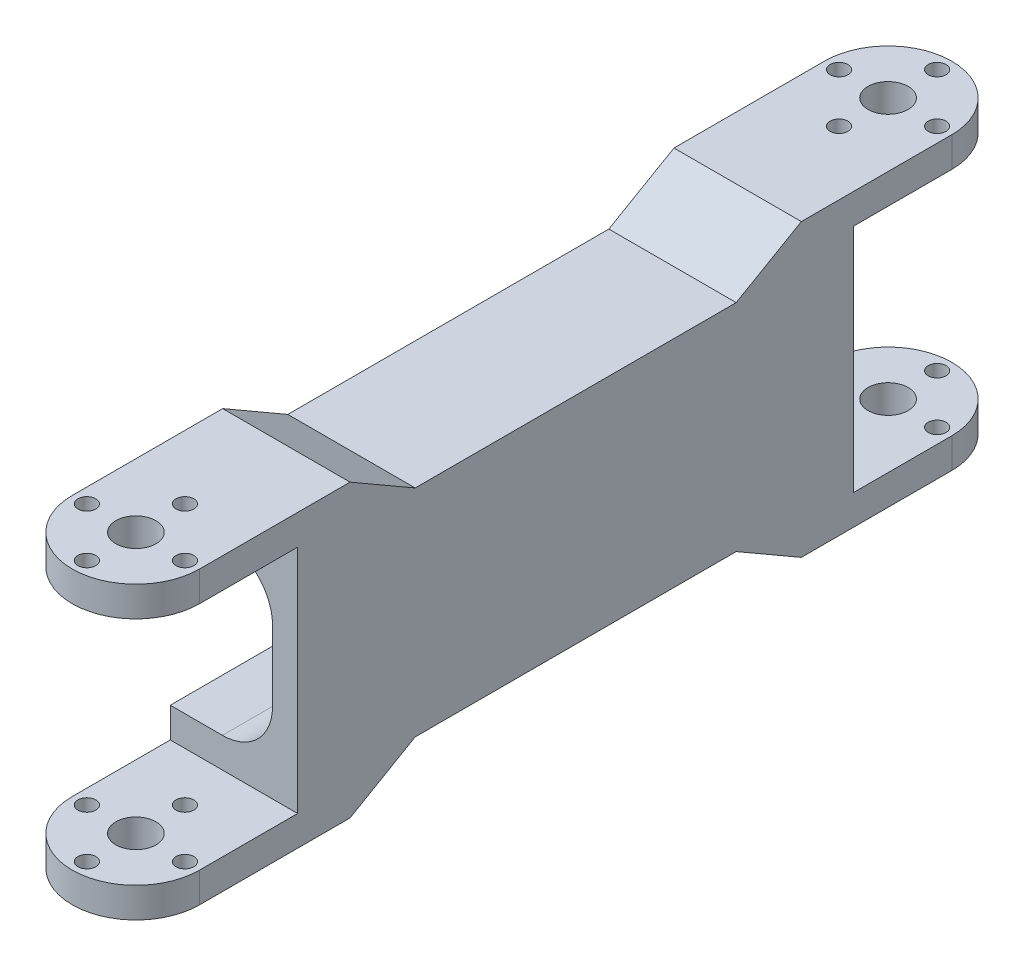
from build123d import *

# Parameters (mm, degrees)
BOSS_EXTRUDE1_DEPTH          = 29
CUT_EXTRUDE1_DEPTH           = 96.799008346
CUT_EXTRUDE2_DEPTH           = 96.799008346
CUT_EXTRUDE2_DEPTH_BACK      = 96.799008346
SKETCH4_W                    = 32.25
SKETCH4_H                    = 6
SKETCH5_W                    = 175.4
SKETCH5_H                    = 34
CUT_EXTRUDE3_DEPTH           = 20.4
SKETCH6_W                    = 29.649504938
SKETCH6_H                    = 34
CUT_EXTRUDE4_DEPTH           = 95.596247283
SKETCH7_W                    = 29.649504938
SKETCH7_H                    = 34
CUT_EXTRUDE5_DEPTH           = 95.596247283
F_5_32_0_14_DIAMETER_HOLE1_D = 3.556
SKETCH13_R                   = 4
CUT_EXTRUDE6_DEPTH           = 106.908356611
FILLET1_R                    = 10
FILLET2_R                    = 10


with BuildPart() as part:
    # Sketch1 → Boss-Extrude1 (new, symmetric)
    with BuildSketch(Plane(origin=(0, 0, 0), x_dir=(1, 0, 0), z_dir=(0, 1, 0))):
        with BuildLine():
            Line((-12.7, 75), (-12.7, -75))
            ThreePointArc((-12.7, -75), (0, -87.7), (12.7, -75))
            Line((12.7, -75), (12.7, 75))
            ThreePointArc((12.7, 75), (0, 87.7), (-12.7, 75))
        make_face()
    extrude(amount=BOSS_EXTRUDE1_DEPTH, both=True)

    # Sketch3 → Cut-Extrude1 (cut, symmetric)
    with BuildSketch(Plane.ZY.offset(12.7)):
        Polygon((-45, 29), (-32.009618943, 21.5), (32.009618943, 21.5), (45, 29), align=None)
    cut_extrude1 = extrude(amount=CUT_EXTRUDE1_DEPTH, both=True, mode=Mode.SUBTRACT)

    # Mirror1: Cut-Extrude1 across plane
    add(cut_extrude1.mirror(Plane.ZX), mode=Mode.SUBTRACT)

    # Sketch4 → Cut-Extrude2 (cut, two sides: drawn at the far end of the back side and taken through both)
    with BuildSketch(Plane.ZY.offset(12.7).offset(-CUT_EXTRUDE2_DEPTH_BACK)):
        with Locations((71.575, 20)):
            Rectangle(SKETCH4_W, SKETCH4_H)
        with Locations((-71.575, 20)):
            Rectangle(SKETCH4_W, SKETCH4_H)
        with Locations((-71.575, -20)):
            Rectangle(SKETCH4_W, SKETCH4_H)
        with Locations((71.575, -20)):
            Rectangle(SKETCH4_W, SKETCH4_H)
    extrude(amount=CUT_EXTRUDE2_DEPTH + CUT_EXTRUDE2_DEPTH_BACK, mode=Mode.SUBTRACT)

    # Sketch5 → Cut-Extrude3 (cut)
    with BuildSketch(Plane.ZY.offset(12.7)):
        Rectangle(SKETCH5_W, SKETCH5_H)
    extrude(amount=-CUT_EXTRUDE3_DEPTH, mode=Mode.SUBTRACT)

    # Sketch6 → Cut-Extrude4 (cut, through all)
    with BuildSketch(Plane.ZY.offset(-7.7)):
        with Locations((70.274752469, 0)):
            Rectangle(SKETCH6_W, SKETCH6_H)
    extrude(amount=-CUT_EXTRUDE4_DEPTH, mode=Mode.SUBTRACT)

    # Sketch7 → Cut-Extrude5 (cut, through all)
    with BuildSketch(Plane.ZY.offset(-7.7)):
        with Locations((-70.274752469, 0)):
            Rectangle(SKETCH7_W, SKETCH7_H)
    extrude(amount=-CUT_EXTRUDE5_DEPTH, mode=Mode.SUBTRACT)

    # 5/32 (0.14) Diameter Hole1 (through all)
    with Locations(Plane(origin=(0, 29, 0), x_dir=(1, 0, 0), z_dir=(0, 1, 0))):
        with Locations((0, -65.221), (-9.779, -75), (9.779, -75), (0, -84.779)):
            f_5_32_0_14_diameter_hole1 = Hole(F_5_32_0_14_DIAMETER_HOLE1_D / 2)

    # Mirror3: 5/32 (0.14) Diameter Hole1 across plane
    add(f_5_32_0_14_diameter_hole1.mirror(Plane.XY), mode=Mode.SUBTRACT)

    # Sketch13 → Cut-Extrude6 (cut, symmetric)
    with BuildSketch(Plane.XZ.offset(29)):
        with Locations(Location((0, -75, 0), (0, 0, 270))):
            Circle(SKETCH13_R)
    cut_extrude6 = extrude(amount=CUT_EXTRUDE6_DEPTH, both=True, mode=Mode.SUBTRACT)

    # Mirror4: Cut-Extrude6 across plane
    add(cut_extrude6.mirror(Plane.XY), mode=Mode.SUBTRACT)

    # Fillet1
    fillet1_edges = [part.edges().sort_by_distance(p)[0] for p in [
        (7.7, 17, 0),
    ]]
    fillet(fillet1_edges, radius=FILLET1_R)

    # Fillet2
    fillet2_edges = [part.edges().sort_by_distance(p)[0] for p in [
        (7.7, -17, 0),
    ]]
    fillet(fillet2_edges, radius=FILLET2_R)


solid = part.part
